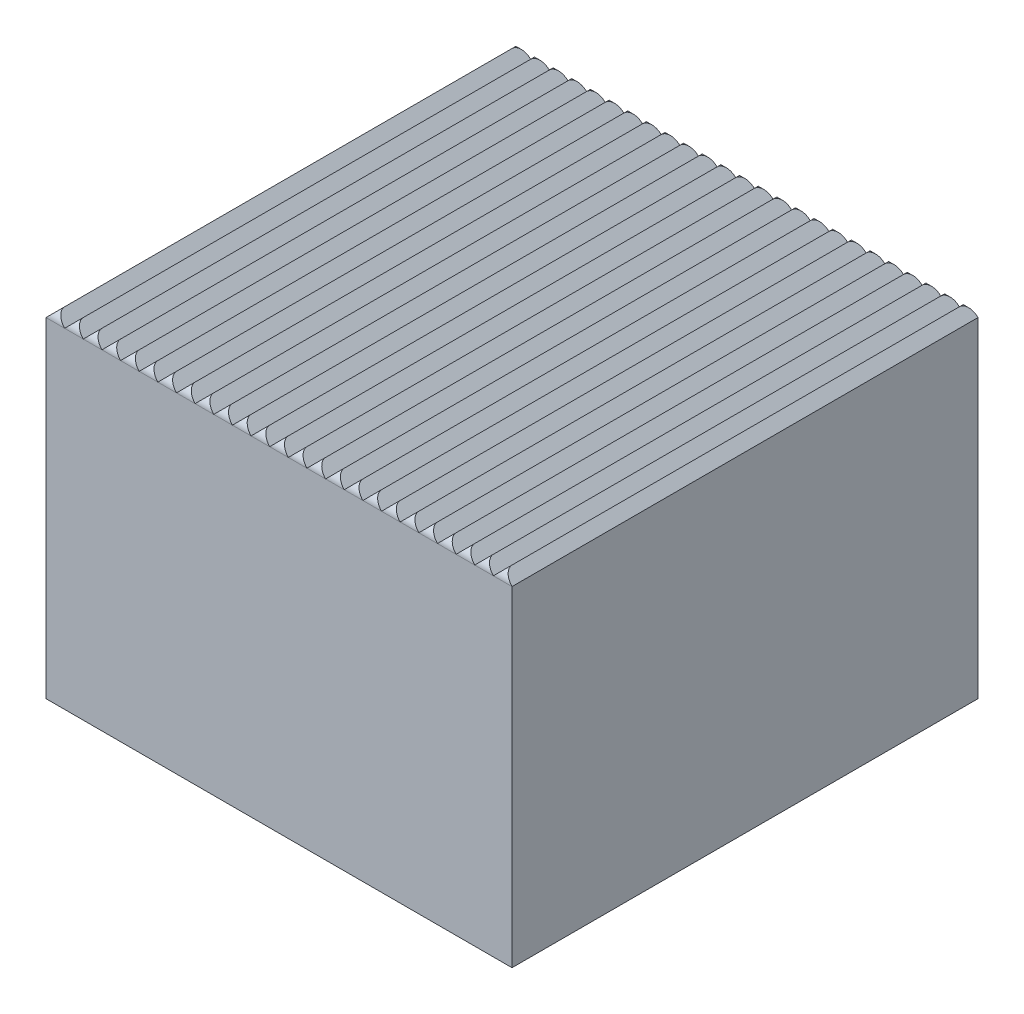
from build123d import *

# Parameters (mm, degrees)
SKETCH1_W           = 60
SKETCH1_H           = 60
SKETCH1_W_2         = 55
SKETCH1_H_2         = 55
BOSS_EXTRUDE1_DEPTH = 40
SKETCH2_W           = 60
SKETCH2_H           = 60
BOSS_EXTRUDE2_DEPTH = 2.5
BOSS_EXTRUDE3_DEPTH = 60
CUT_EXTRUDE1_REACH  = 82.061


with BuildPart() as part:
    # Sketch1 → Boss-Extrude1 (new body)
    with BuildSketch(Plane(origin=(0, 0, 0), x_dir=(1, 0, 0), z_dir=(0, 1, 0))):
        Rectangle(SKETCH1_W, SKETCH1_H)
        Rectangle(SKETCH1_W_2, SKETCH1_H_2, mode=Mode.SUBTRACT)
    extrude(amount=BOSS_EXTRUDE1_DEPTH)

    # Sketch2 → Boss-Extrude2 (add)
    with BuildSketch(Plane(origin=(0, 40, 0), x_dir=(1, 0, 0), z_dir=(0, 1, 0))):
        Rectangle(SKETCH2_W, SKETCH2_H)
    extrude(amount=BOSS_EXTRUDE2_DEPTH)

    # Sketch3 → Boss-Extrude3 (add)
    with BuildSketch(Plane(origin=(0, 0, -30), x_dir=(-1, 0, 0), z_dir=(0, 0, -1))):
        Polygon((-30, 42.5), (-28.8, 43.7), (-27.6, 42.5), (-26.4, 43.7), (-25.2, 42.5), (-24, 43.7), (-22.8, 42.5), (-21.6, 43.7), (-20.4, 42.5), (-19.2, 43.7), (-18, 42.5), (-16.8, 43.7), (-15.6, 42.5), (-14.4, 43.7), (-13.2, 42.5), (-12, 43.7), (-10.8, 42.5), (-9.6, 43.7), (-8.4, 42.5), (-7.2, 43.7), (-6, 42.5), (-4.8, 43.7), (-3.6, 42.5), (-2.4, 43.7), (-1.2, 42.5), (0, 43.7), (1.2, 42.5), (2.4, 43.7), (3.6, 42.5), (4.8, 43.7), (6, 42.5), (7.2, 43.7), (8.4, 42.5), (9.6, 43.7), (10.8, 42.5), (12, 43.7), (13.2, 42.5), (14.4, 43.7), (15.6, 42.5), (16.8, 43.7), (18, 42.5), (19.2, 43.7), (20.4, 42.5), (21.6, 43.7), (22.8, 42.5), (24, 43.7), (25.2, 42.5), (26.4, 43.7), (27.6, 42.5), (28.8, 43.7), (30, 42.5), (30, 42.170064374), (-30, 42.170064374), align=None)
    extrude(amount=-BOSS_EXTRUDE3_DEPTH)

    # Cut-Extrude1: up to this face of the body (flat: up to its plane)
    cut_extrude1_end = Plane(part.part.faces().sort_by_distance((30, 21.25, 0))[0])
    # Sketch4 → Cut-Extrude1 (cut, up to the picked face)
    with BuildSketch(Plane.ZY.offset(30), mode=Mode.PRIVATE) as cut_extrude1_sk1:
        with BuildLine():
            Line((-30, 42.5), (-30, 43.7))
            Line((-30, 43.7), (-28.8, 43.7))
            ThreePointArc((-28.8, 43.7), (-29.648528137, 43.348528137), (-30, 42.5))
        make_face()
    cut_extrude1_tool1 = split(extrude(cut_extrude1_sk1.sketch, amount=-CUT_EXTRUDE1_REACH, mode=Mode.PRIVATE), bisect_by=cut_extrude1_end, keep=Keep.BOTH, mode=Mode.PRIVATE)
    cut_extrude1 = cut_extrude1_tool1.solids().sort_by(Axis((-30, 43.431958, -29.731958), (1, 0, 0)))[0]
    add(cut_extrude1, mode=Mode.SUBTRACT)

    # Mirror1: Cut-Extrude1 across plane
    add(cut_extrude1.mirror(Plane.XY), mode=Mode.SUBTRACT)


solid = part.part
